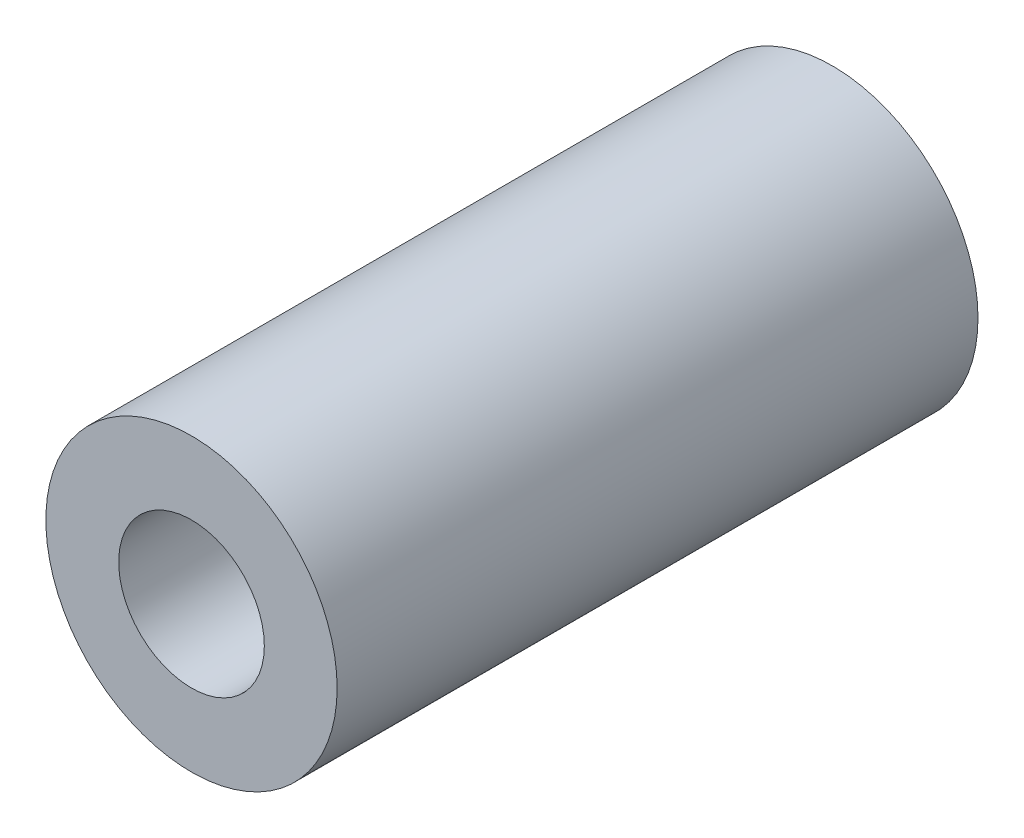
from build123d import *

# Parameters (mm, degrees)
SKETCH_1_R      = 5
SKETCH_1_R_2    = 2.5
EXTRUDE_1_DEPTH = 22


with BuildPart() as part:
    # 草图1 → 凸台-拉伸1 (new body)
    with BuildSketch(Plane.XY):
        Circle(SKETCH_1_R)
        Circle(SKETCH_1_R_2, mode=Mode.SUBTRACT)
    extrude(amount=EXTRUDE_1_DEPTH)


solid = part.part
